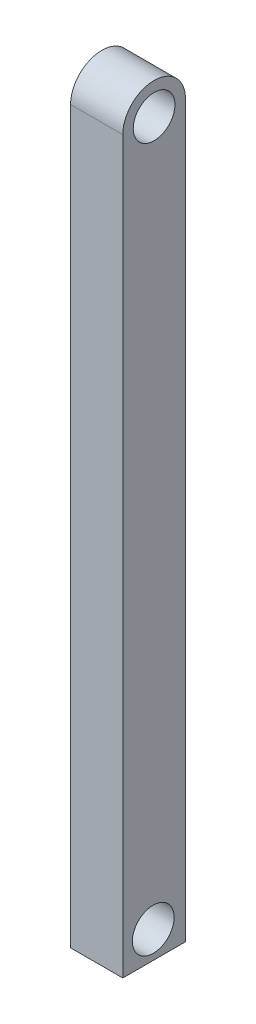
from build123d import *

# Parameters (mm, degrees)
CROQUIS1_W              = 2.5
CROQUIS1_H              = 37
SALIENTE_EXTRUIR1_DEPTH = 3
CORTAR_EXTRUIR7_REACH   = 74.534
CROQUIS10_R             = 1
CROQUIS12_R             = 1
CORTAR_EXTRUIR9_DEPTH   = 10


with BuildPart() as part:
    # Croquis1 → Saliente-Extruir1 (new body)
    with BuildSketch(Plane.XY):
        with Locations((-7.257787801, 53.928529755)):
            Rectangle(CROQUIS1_W, CROQUIS1_H)
    extrude(amount=SALIENTE_EXTRUIR1_DEPTH)

    # Croquis10 → Cortar-Extruir7 (cut, up to next)
    with BuildSketch(Plane(origin=(-6.007787801, 0, 0), x_dir=(0, 0, -1), z_dir=(1, 0, 0)), mode=Mode.PRIVATE) as cortar_extruir7_sk1:
        with Locations(Location((-1.5, 70.40205312, 0), (0, 0, 90))):
            Circle(CROQUIS10_R)
    cortar_extruir7_tool1 = extrude(cortar_extruir7_sk1.sketch, amount=-CORTAR_EXTRUIR7_REACH, mode=Mode.PRIVATE) & part.part
    # Croquis10 → Cortar-Extruir7 (cut, up to next)
    with BuildSketch(Plane(origin=(-6.007787801, 0, 0), x_dir=(0, 0, -1), z_dir=(1, 0, 0)), mode=Mode.PRIVATE) as cortar_extruir7_sk2:
        with BuildLine():
            Line((-3, 70.40205312), (-3, 72.428529755))
            Line((-3, 72.428529755), (0, 72.428529755))
            Line((0, 72.428529755), (0, 70.40205312))
            ThreePointArc((0, 70.40205312), (-1.5, 71.90205312), (-3, 70.40205312))
        make_face()
    cortar_extruir7_tool2 = extrude(cortar_extruir7_sk2.sketch, amount=-CORTAR_EXTRUIR7_REACH, mode=Mode.PRIVATE) & part.part
    add(cortar_extruir7_tool1.solids().sort_by_distance((-6.007788, 70.402053, 1.5))[0], mode=Mode.SUBTRACT)
    add(cortar_extruir7_tool2.solids().sort_by_distance((-6.007788, 71.938281, 1.5))[0], mode=Mode.SUBTRACT)

    # Croquis12 → Cortar-Extruir9 (cut)
    with BuildSketch(Plane(origin=(-6.007787801, 0, 0), x_dir=(0, 0, -1), z_dir=(1, 0, 0))):
        with Locations(Location((-1.541120901, 36.722060173, 0), (0, 0, 90))):
            Circle(CROQUIS12_R)
    extrude(amount=-CORTAR_EXTRUIR9_DEPTH, mode=Mode.SUBTRACT)


solid = part.part
